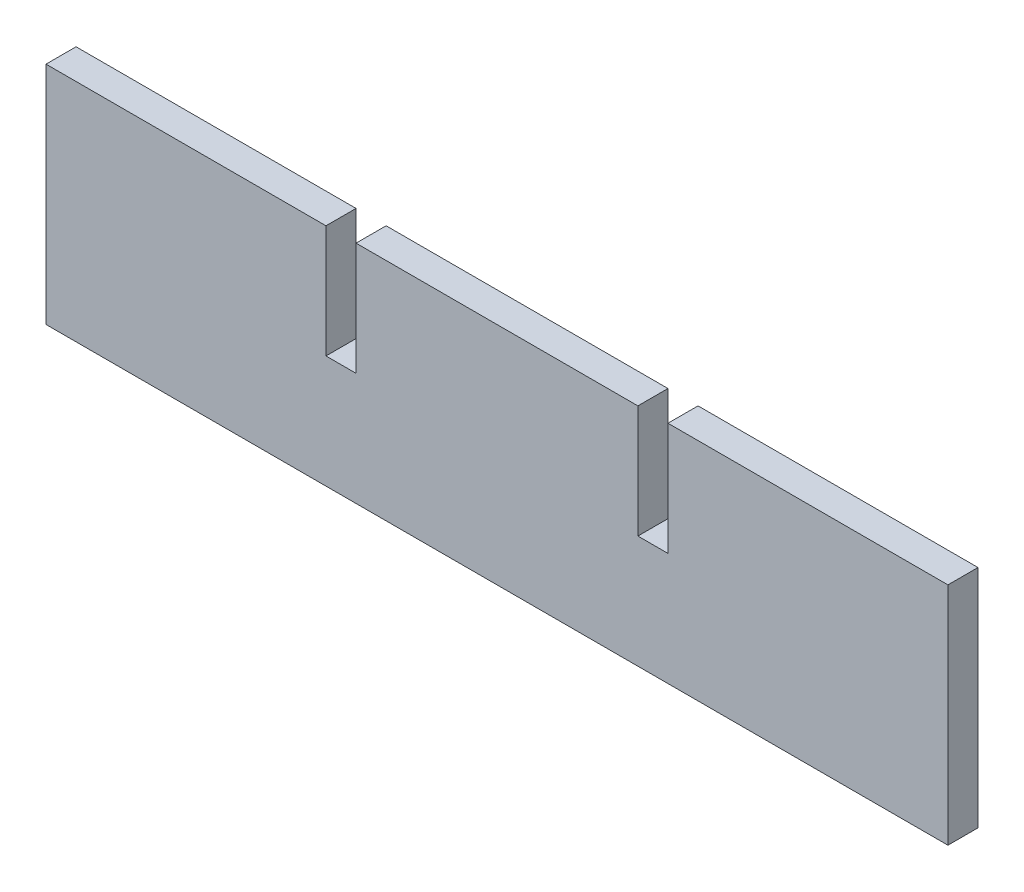
from build123d import *

# Parameters (mm, degrees)
BOSS_EXTRU_1_DEPTH = 8


with BuildPart() as part:
    # Esquisse1 → Boss.-Extru.1 (new body)
    with BuildSketch(Plane.XY):
        Polygon((120, 0), (-120, 0), (-120, 60), (-45.5, 60), (-45.5, 30), (-37.5, 30), (-37.5, 60), (37.5, 60), (37.5, 30), (45.5, 30), (45.5, 60), (120, 60), align=None)
    extrude(amount=BOSS_EXTRU_1_DEPTH)


solid = part.part
